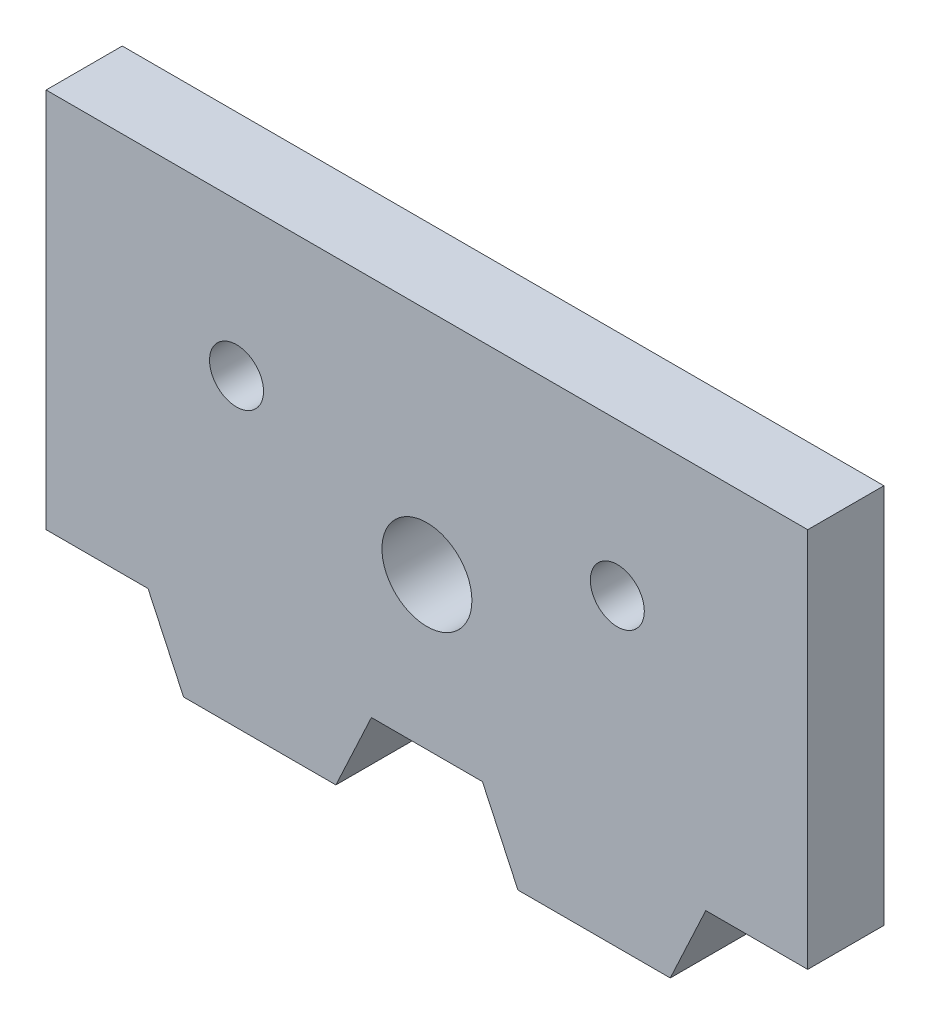
from build123d import *

# Parameters (mm, degrees)
SKETCH1_R           = 7.5
SKETCH1_R_2         = 4.5
BOSS_EXTRUDE1_DEPTH = 12.7


with BuildPart() as part:
    # Sketch1 → Boss-Extrude1 (new body)
    with BuildSketch(Plane.XY):
        Polygon((46.5, -25.264079911), (40.577892741, -37.964079911), (15.177892741, -37.964079911), (9.255785483, -25.264079911), (-9.255785483, -25.264079911), (-15.177892741, -37.964079911), (-40.577892741, -37.964079911), (-46.5, -25.264079911), (-63.5, -25.264079911), (-63.5, 38.235920089), (63.5, 38.235920089), (63.5, -25.264079911), align=None)
        Circle(SKETCH1_R, mode=Mode.SUBTRACT)
        with Locations((31.75, 12.835920089)):
            Circle(SKETCH1_R_2, mode=Mode.SUBTRACT)
        with Locations((-31.75, 12.835920089)):
            Circle(SKETCH1_R_2, mode=Mode.SUBTRACT)
    extrude(amount=BOSS_EXTRUDE1_DEPTH)


solid = part.part
